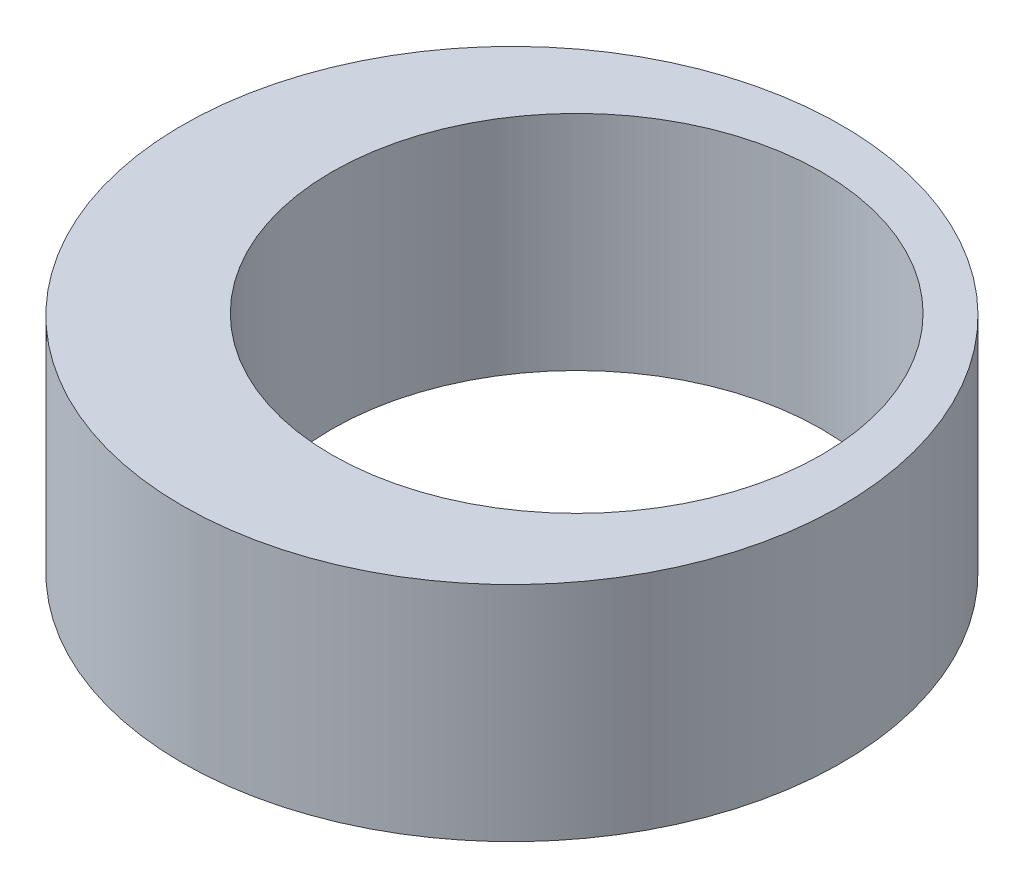
from build123d import *

# Parameters (mm, degrees)
SKETCH1_R           = 7.4
BOSS_EXTRUDE1_DEPTH = 5
SKETCH2_R           = 5.5
CUT_EXTRUDE1_DEPTH  = 5


with BuildPart() as part:
    # Sketch1 → Boss-Extrude1 (new body)
    with BuildSketch(Plane(origin=(0, 0, 0), x_dir=(1, 0, 0), z_dir=(0, 1, 0))):
        with Locations(Location((0, 0, 0), (0, 0, 270))):
            Circle(SKETCH1_R)
    extrude(amount=BOSS_EXTRUDE1_DEPTH)

    # Sketch2 → Cut-Extrude1 (cut)
    with BuildSketch(Plane(origin=(0, 5, 0), x_dir=(1, 0, 0), z_dir=(0, 1, 0))):
        with Locations(Location((0.686398521, 0.767689011, 0), (0, 0, 270))):
            Circle(SKETCH2_R)
    extrude(amount=-CUT_EXTRUDE1_DEPTH, mode=Mode.SUBTRACT)


solid = part.part
